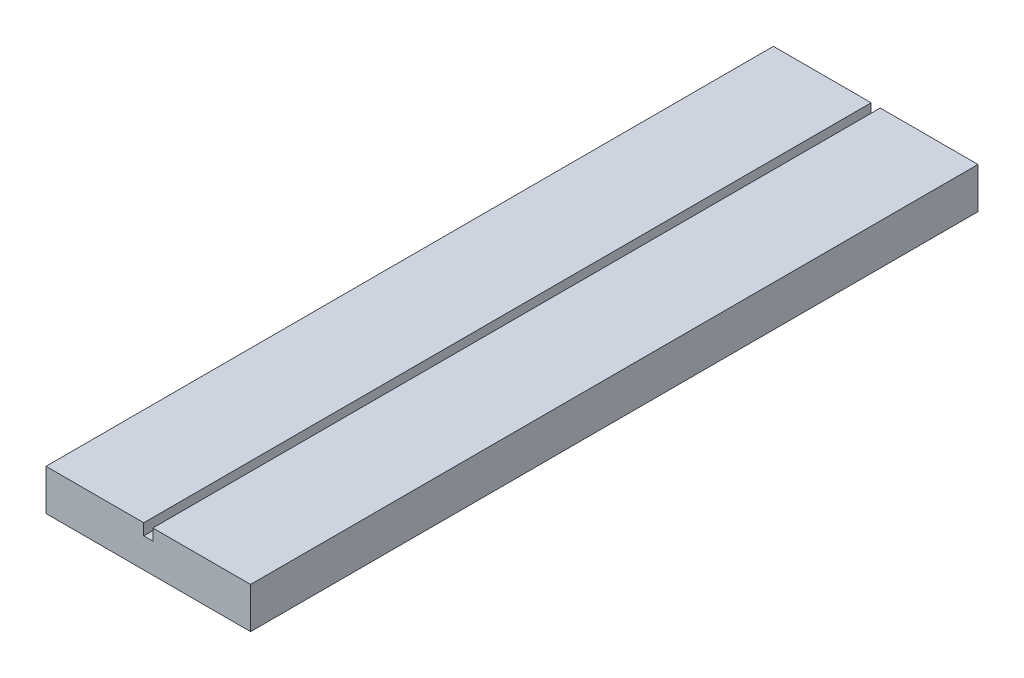
from build123d import *

# Parameters (mm, degrees)
ESQUISSE1_W                  = 45
ESQUISSE1_H                  = 160
BOSS_EXTRU_1_DEPTH           = 9
ENL_V_MAT_EXTRU_1_DEPTH      = 162.824750888
ENL_V_MAT_EXTRU_1_DEPTH_BACK = 162.824750888


with BuildPart() as part:
    # Esquisse1 → Boss.-Extru.1 (new body)
    with BuildSketch(Plane(origin=(0, 0, 0), x_dir=(1, 0, 0), z_dir=(0, 1, 0))):
        Rectangle(ESQUISSE1_W, ESQUISSE1_H)
    extrude(amount=BOSS_EXTRU_1_DEPTH)

    # Esquisse3 → Enlèv. mat.-Extru.1 (cut, two sides: drawn at the far end of the back side and taken through both)
    with BuildSketch(Plane.XY.offset(80).offset(-ENL_V_MAT_EXTRU_1_DEPTH_BACK)):
        Polygon((-1, 69.328918129), (-1, 9), (-1, 6.5), (1, 6.5), (1, 9), (1, 69.328918129), (1, 189.986754386), (-1, 189.986754386), align=None)
    extrude(amount=ENL_V_MAT_EXTRU_1_DEPTH + ENL_V_MAT_EXTRU_1_DEPTH_BACK, mode=Mode.SUBTRACT)


solid = part.part
